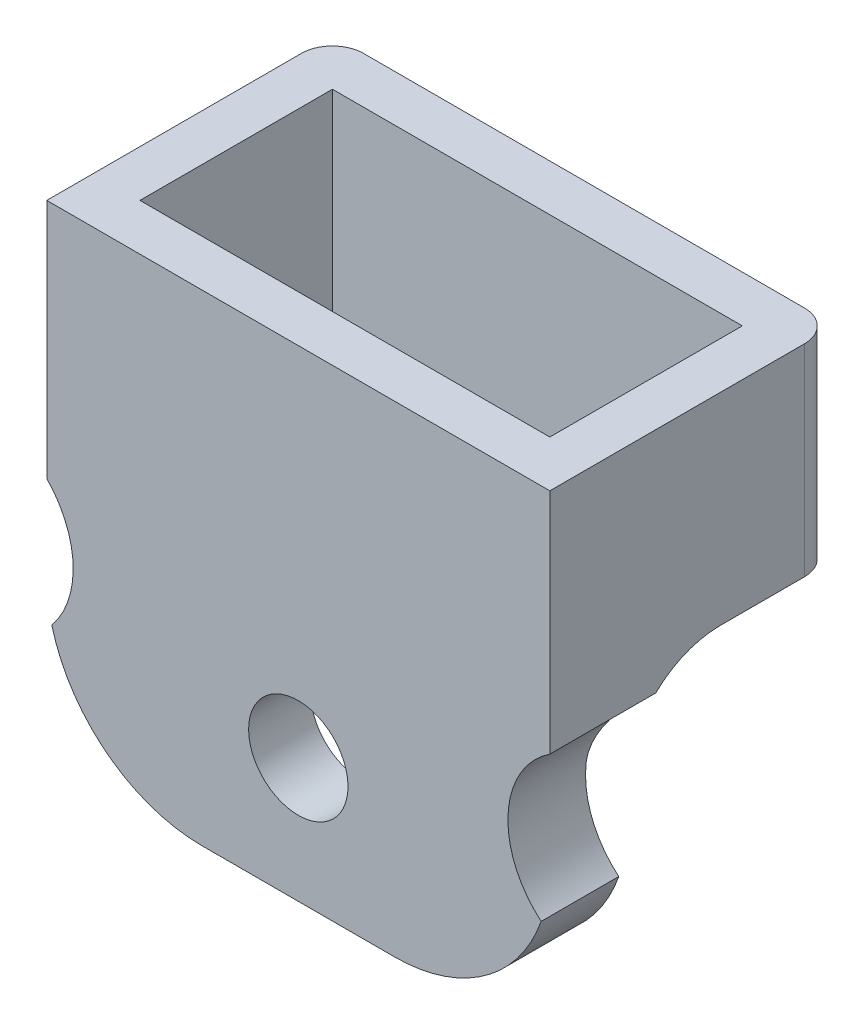
from build123d import *

# Parameters (mm, degrees)
CROQUIS1_W              = 16.2
CROQUIS1_H              = 9.2
CROQUIS1_W_2            = 13.2
CROQUIS1_H_2            = 6.2
SALIENTE_EXTRUIR1_DEPTH = 6.5
CROQUIS3_W              = 16.2
CROQUIS3_H              = 2.5
SALIENTE_EXTRUIR2_DEPTH = 9
CROQUIS4_R              = 1.6
CORTAR_EXTRUIR1_DEPTH   = 2.5
REDONDEO1_R             = 1
REDONDEO2_R             = 5
REDONDEO3_R             = 3
CORTAR_EXTRUIR2_REACH   = 21.538
CROQUIS5_R              = 3
CROQUIS6_R              = 2.9
CORTAR_EXTRUIR3_DEPTH   = 0.5


with BuildPart() as part:
    # Croquis1 → Saliente-Extruir1 (new body)
    with BuildSketch(Plane(origin=(0, 0, 0), x_dir=(1, 0, 0), z_dir=(0, 1, 0))):
        with Locations((6.6, 3.1)):
            Rectangle(CROQUIS1_W, CROQUIS1_H)
        with Locations((6.6, 3.1)):
            Rectangle(CROQUIS1_W_2, CROQUIS1_H_2, mode=Mode.SUBTRACT)
    extrude(amount=SALIENTE_EXTRUIR1_DEPTH)

    # Croquis3 → Saliente-Extruir2 (add)
    with BuildSketch(Plane.XZ):
        with Locations((6.6, 0.25)):
            Rectangle(CROQUIS3_W, CROQUIS3_H)
    extrude(amount=SALIENTE_EXTRUIR2_DEPTH)

    # Croquis4 → Cortar-Extruir1 (cut)
    with BuildSketch(Plane(origin=(0, 0, -1), x_dir=(-1, 0, 0), z_dir=(0, 0, -1))):
        with Locations((-6.6, -5)):
            Circle(CROQUIS4_R)
    extrude(amount=-CORTAR_EXTRUIR1_DEPTH, mode=Mode.SUBTRACT)

    # Redondeo1
    redondeo1_edges = [part.edges().sort_by_distance(p)[0] for p in [
        (-1.5, 3.25, -7.7),
        (14.7, 3.25, -7.7),
    ]]
    fillet(redondeo1_edges, radius=REDONDEO1_R)

    # Redondeo2
    redondeo2_edges = [part.edges().sort_by_distance(p)[0] for p in [
        (14.7, -9, 0.25),
        (-1.5, -9, 0.25),
    ]]
    fillet(redondeo2_edges, radius=REDONDEO2_R)

    # Redondeo3
    redondeo3_edges = [part.edges().sort_by_distance(p)[0] for p in [
        (13.95, 0, -1),
        (-0.75, 0, -1),
    ]]
    fillet(redondeo3_edges, radius=REDONDEO3_R)

    # Cortar-Extruir2: up to this face of the body (flat: up to its plane)
    cortar_extruir2_end = Plane(part.part.faces().sort_by_distance((6.6, -0.813832354, 1.5))[0])
    # Croquis5 → Cortar-Extruir2 (cut, up to the picked face)
    with BuildSketch(Plane(origin=(0, 0, -7.7), x_dir=(-1, 0, 0), z_dir=(0, 0, -1)), mode=Mode.PRIVATE) as cortar_extruir2_sk1:
        with Locations((-16.35, -3.35)):
            Circle(CROQUIS5_R)
    cortar_extruir2_tool1 = split(extrude(cortar_extruir2_sk1.sketch, amount=-CORTAR_EXTRUIR2_REACH, mode=Mode.PRIVATE), bisect_by=cortar_extruir2_end, keep=Keep.BOTH, mode=Mode.PRIVATE)
    # Croquis5 → Cortar-Extruir2 (cut, up to the picked face)
    with BuildSketch(Plane(origin=(0, 0, -7.7), x_dir=(-1, 0, 0), z_dir=(0, 0, -1)), mode=Mode.PRIVATE) as cortar_extruir2_sk2:
        with Locations((3.65, -3.35)):
            Circle(CROQUIS5_R)
    cortar_extruir2_tool2 = split(extrude(cortar_extruir2_sk2.sketch, amount=-CORTAR_EXTRUIR2_REACH, mode=Mode.PRIVATE), bisect_by=cortar_extruir2_end, keep=Keep.BOTH, mode=Mode.PRIVATE)
    add(cortar_extruir2_tool1.solids().sort_by(Axis((16.35, -3.35, -7.7), (0, 0, 1)))[0], mode=Mode.SUBTRACT)
    add(cortar_extruir2_tool2.solids().sort_by(Axis((-3.65, -3.35, -7.7), (0, 0, 1)))[0], mode=Mode.SUBTRACT)

    # Croquis6 → Cortar-Extruir3 (cut)
    with BuildSketch(Plane(origin=(0, 0, -1), x_dir=(-1, 0, 0), z_dir=(0, 0, -1))):
        with Locations((-6.6, -5)):
            Circle(CROQUIS6_R)
    extrude(amount=-CORTAR_EXTRUIR3_DEPTH, mode=Mode.SUBTRACT)


solid = part.part
